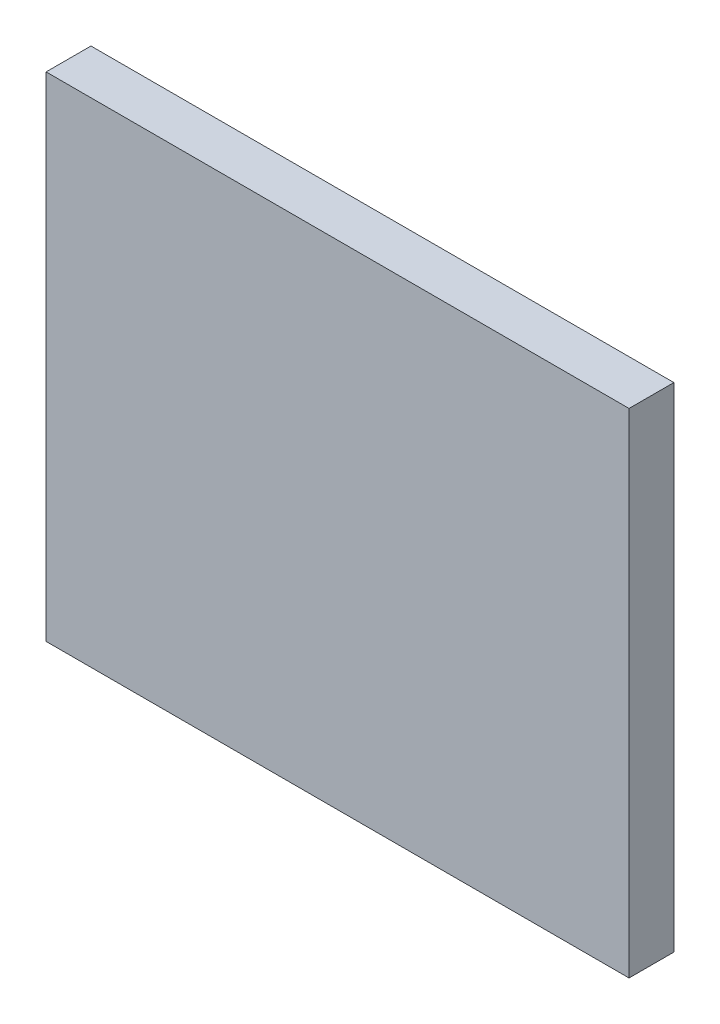
from build123d import *

# Parameters (mm, degrees)
SKETCH1_W           = 330.2
SKETCH1_H           = 279.4
BOSS_EXTRUDE1_DEPTH = 25.4


with BuildPart() as part:
    # Sketch1 → Boss-Extrude1 (new body)
    with BuildSketch(Plane.XY):
        with Locations((165.1, 139.7)):
            Rectangle(SKETCH1_W, SKETCH1_H)
    extrude(amount=BOSS_EXTRUDE1_DEPTH)


solid = part.part
